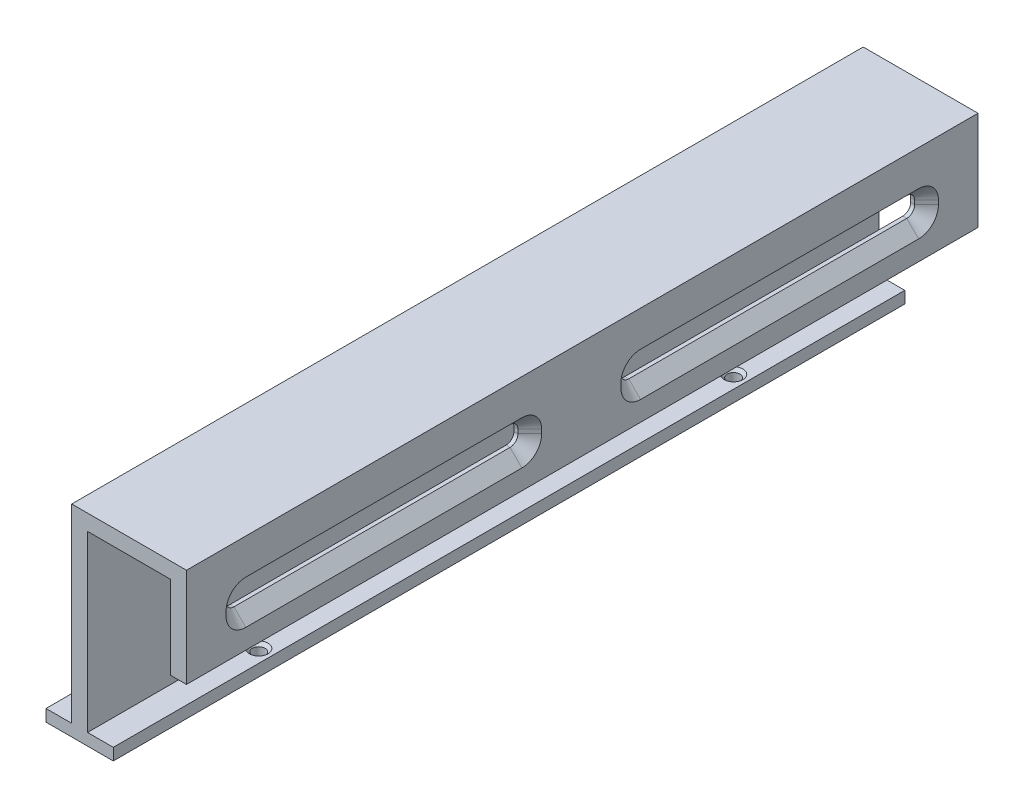
from build123d import *

# Parameters (mm, degrees)
BOSS_EXTRUDE1_DEPTH = 200
CUT_EXTRUDE1_DEPTH  = 4
CHAMFER1_SIZE       = 3
SKETCH3_R           = 1.6
CUT_EXTRUDE2_DEPTH  = 3
CHAMFER2_SIZE       = 0.75


with BuildPart() as part:
    # Sketch1 → Boss-Extrude1 (new body)
    with BuildSketch(Plane.XY):
        Polygon((0, 0), (0, 48), (29, 48), (29, 23), (25, 23), (25, 44), (4, 44), (4, 0), (10.5, 0), (10.5, -3), (-6.5, -3), (-6.5, 0), align=None)
    extrude(amount=-BOSS_EXTRUDE1_DEPTH)

    # Sketch2 → Cut-Extrude1 (cut)
    with BuildSketch(Plane(origin=(29, 0, 0), x_dir=(0, 0, -1), z_dir=(1, 0, 0))):
        with BuildLine():
            Line((15, 36), (84.75, 36))
            ThreePointArc((84.75, 36), (86.164213562, 35.414213562), (86.75, 34))
            Line((86.75, 34), (86.75, 33))
            ThreePointArc((86.75, 33), (86.164213562, 31.585786438), (84.75, 31))
            Line((84.75, 31), (15, 31))
            ThreePointArc((15, 31), (13.585786438, 31.585786438), (13, 33))
            Line((13, 33), (13, 34))
            ThreePointArc((13, 34), (13.585786438, 35.414213562), (15, 36))
        make_face()
        with BuildLine():
            Line((114.75, 36), (185, 36))
            ThreePointArc((185, 36), (186.414213562, 35.414213562), (187, 34))
            Line((187, 34), (187, 33))
            ThreePointArc((187, 33), (186.414213562, 31.585786438), (185, 31))
            Line((185, 31), (114.75, 31))
            ThreePointArc((114.75, 31), (113.335786438, 31.585786438), (112.75, 33))
            Line((112.75, 33), (112.75, 34))
            ThreePointArc((112.75, 34), (113.335786438, 35.414213562), (114.75, 36))
        make_face()
    extrude(amount=-CUT_EXTRUDE1_DEPTH, mode=Mode.SUBTRACT)

    # Chamfer1
    chamfer1_edges = [part.edges().sort_by_distance(p)[0] for p in [
        (29, 31.585786438, -186.414213562),
        (29, 33.5, -187),
        (29, 35.414213562, -186.414213562),
        (29, 36, -149.875),
        (29, 35.414213562, -113.335786438),
        (29, 33.5, -112.75),
        (29, 31.585786438, -113.335786438),
        (29, 31, -149.875),
        (29, 31.585786438, -86.164213562),
        (29, 33.5, -86.75),
        (29, 35.414213562, -86.164213562),
        (29, 36, -49.875),
        (29, 35.414213562, -13.585786438),
        (29, 33.5, -13),
        (29, 31.585786438, -13.585786438),
        (29, 31, -49.875),
    ]]
    chamfer(chamfer1_edges, length=CHAMFER1_SIZE)

    # Sketch3 → Cut-Extrude2 (cut)
    with BuildSketch(Plane.XZ.offset(3)):
        with Locations((-3.25, -40)):
            Circle(SKETCH3_R)
        with Locations(Location((-3.25, -160, 0), (0, 0, 180))):
            Circle(SKETCH3_R)
        with Locations((7.25, -160)):
            Circle(SKETCH3_R)
        with Locations(Location((7.25, -40, 0), (0, 0, 180))):
            Circle(SKETCH3_R)
    extrude(amount=-CUT_EXTRUDE2_DEPTH, mode=Mode.SUBTRACT)

    # Chamfer2
    chamfer2_edges = [part.edges().sort_by_distance(p)[0] for p in [
        (8.85, 0, -40),
        (5.65, 0, -160),
        (-1.65, 0, -160),
        (-4.85, 0, -40),
    ]]
    chamfer(chamfer2_edges, length=CHAMFER2_SIZE)


solid = part.part
